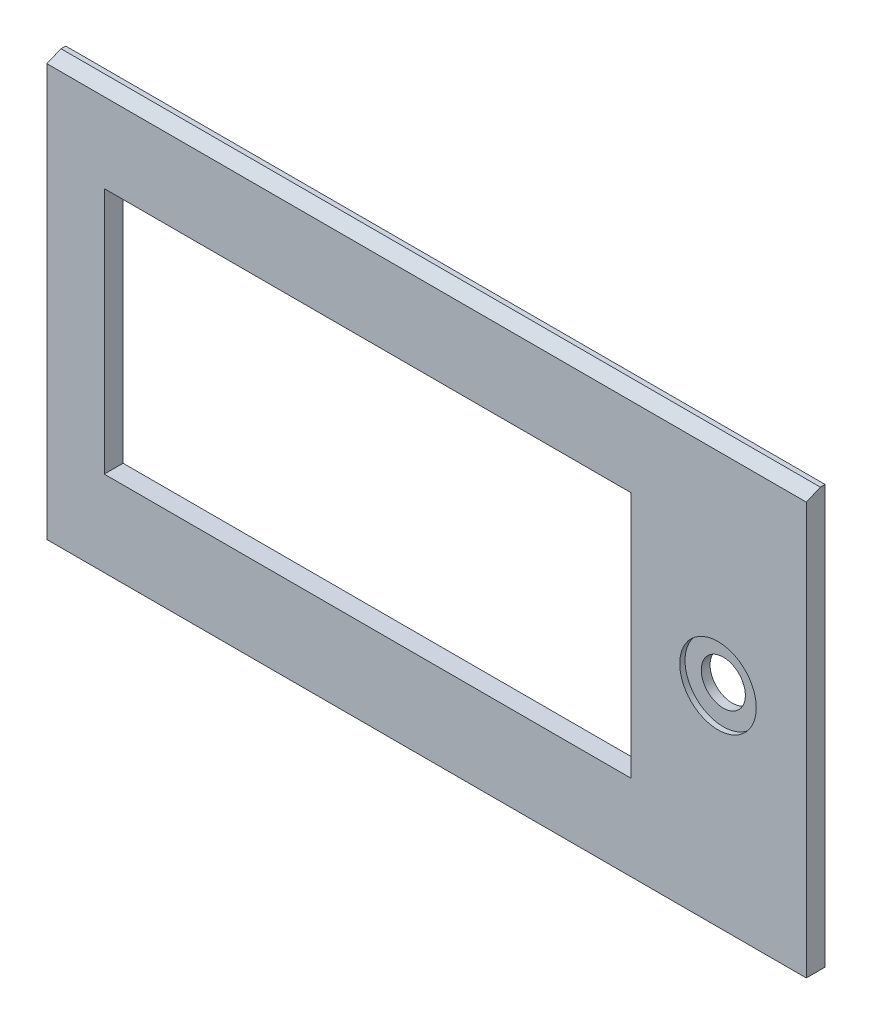
from build123d import *

# Parameters (mm, degrees)
SKETCH1_R           = 3.75
SKETCH1_W           = 89.5
SKETCH1_H           = 42
BOSS_EXTRUDE1_DEPTH = 3.2
CHAMFER1_SIZE       = 2.4
CHAMFER1_SIZE2      = 0.99411255
SKETCH3_W           = 15
SKETCH3_H           = 15
CUT_EXTRUDE2_DEPTH  = 0.8
SKETCH4_R           = 6.5
CUT_EXTRUDE3_DEPTH  = 0.9


with BuildPart() as part:
    # Sketch1 → Boss-Extrude1 (new body)
    with BuildSketch(Plane.XY):
        Polygon((-9.75, 56.5), (99.25, 56.5), (119.25, 56.5), (119.25, -14.5), (99.25, -14.5), (-9.75, -14.5), align=None)
        with Locations((104.25, 21)):
            Circle(SKETCH1_R, mode=Mode.SUBTRACT)
        with Locations((44.75, 21)):
            Rectangle(SKETCH1_W, SKETCH1_H, mode=Mode.SUBTRACT)
    extrude(amount=BOSS_EXTRUDE1_DEPTH)

    # Chamfer1
    chamfer1_edges = [part.edges().sort_by_distance(p)[0] for p in [
        (54.75, 56.5, 3.2),
    ]]
    chamfer1_side = [part.faces().sort_by_distance(p)[0] for p in [
        (54.75, 56.5, 1.6),
    ]]
    chamfer(chamfer1_edges, length=CHAMFER1_SIZE, length2=CHAMFER1_SIZE2, reference=chamfer1_side[0])

    # Sketch3 → Cut-Extrude2 (cut)
    with BuildSketch(Plane(origin=(0, 0, 0), x_dir=(-1, 0, 0), z_dir=(0, 0, -1))):
        with Locations((-104.25, 21)):
            Rectangle(SKETCH3_W, SKETCH3_H)
    extrude(amount=-CUT_EXTRUDE2_DEPTH, mode=Mode.SUBTRACT)

    # Sketch4 → Cut-Extrude3 (cut)
    with BuildSketch(Plane.XY.offset(3.2)):
        with Locations((104.25, 21)):
            Circle(SKETCH4_R)
    extrude(amount=-CUT_EXTRUDE3_DEPTH, mode=Mode.SUBTRACT)


solid = part.part
